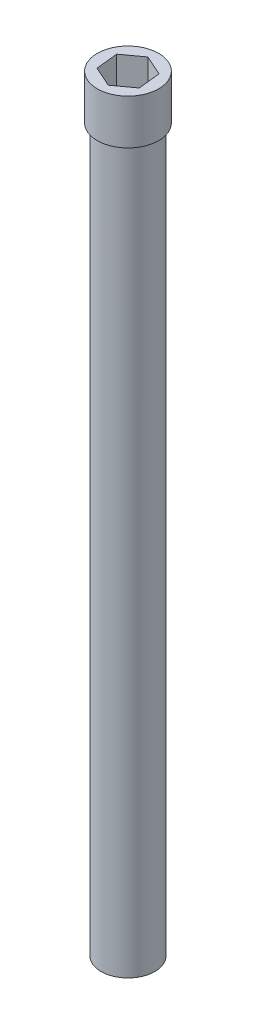
from build123d import *

# Parameters (mm, degrees)
SKETCH1_R           = 3
BOSS_EXTRUDE1_DEPTH = 30
SKETCH2_R           = 3.420462188
BOSS_EXTRUDE2_DEPTH = 5
CUT_EXTRUDE1_DEPTH  = 4
BOSS_EXTRUDE3_START = 50.360841313
SKETCH4_R           = 3
BOSS_EXTRUDE3_DEPTH = 50.360841313


with BuildPart() as part:
    # Sketch1 → Boss-Extrude1 (new body)
    with BuildSketch(Plane(origin=(0, 0, 0), x_dir=(1, 0, 0), z_dir=(0, 1, 0))):
        with Locations(Location((0, 0, 0), (0, 0, 270))):
            Circle(SKETCH1_R)
    extrude(amount=BOSS_EXTRUDE1_DEPTH)

    # Sketch2 → Boss-Extrude2 (add)
    with BuildSketch(Plane(origin=(0, 30, 0), x_dir=(1, 0, 0), z_dir=(0, 1, 0))):
        with Locations(Location((0, 0, 0), (0, 0, 270))):
            Circle(SKETCH2_R)
    extrude(amount=BOSS_EXTRUDE2_DEPTH)

    # Sketch3 → Cut-Extrude1 (cut)
    with BuildSketch(Plane(origin=(0, 35, 0), x_dir=(1, 0, 0), z_dir=(0, 1, 0))):
        Polygon((-0.25878856, 2.462260088), (-2.261774067, 1.007012576), (-2.002985506, -1.455247511), (0.25878856, -2.462260088), (2.261774067, -1.007012576), (2.002985506, 1.455247511), align=None)
    extrude(amount=-CUT_EXTRUDE1_DEPTH, mode=Mode.SUBTRACT)

    # Sketch4 → Boss-Extrude3 (add)
    with BuildSketch(Plane(origin=(0, 0, 0), x_dir=(-1, 0, 0), z_dir=(0, -1, 0)).offset(BOSS_EXTRUDE3_START)):
        with Locations(Location((0, 0, 0), (0, 0, 90))):
            Circle(SKETCH4_R)
    extrude(amount=-BOSS_EXTRUDE3_DEPTH)


solid = part.part
